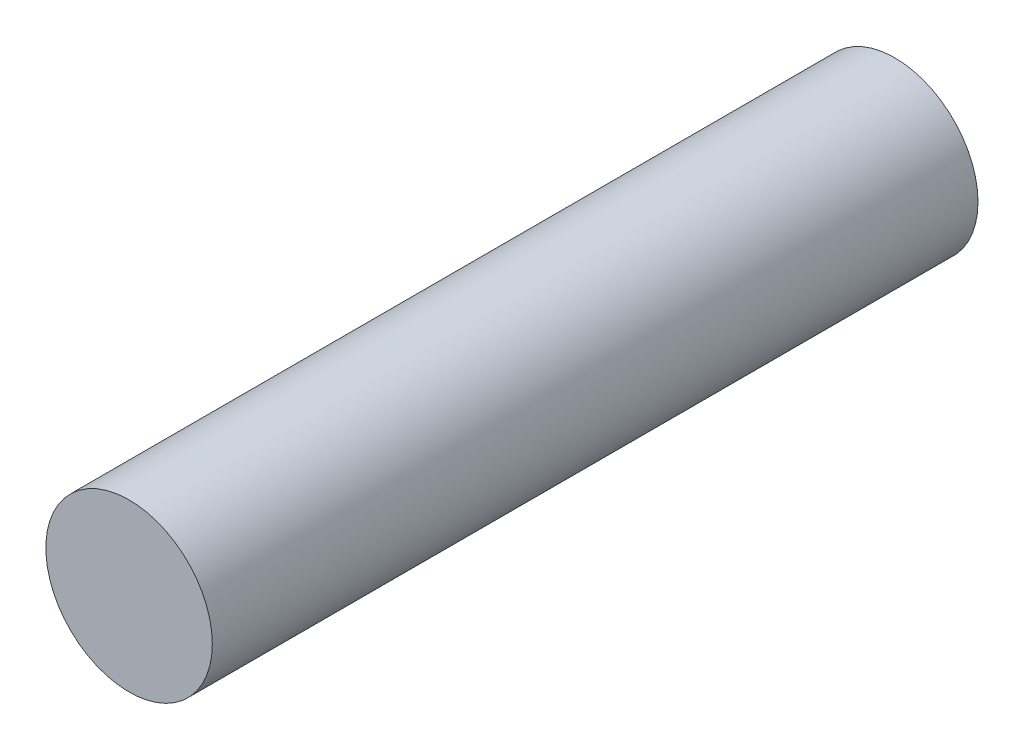
from build123d import *

# Parameters (mm, degrees)
SKETCH1_R           = 2.5
BOSS_EXTRUDE1_DEPTH = 23


with BuildPart() as part:
    # Sketch1 → Boss-Extrude1 (new body)
    with BuildSketch(Plane.XY):
        Circle(SKETCH1_R)
    extrude(amount=BOSS_EXTRUDE1_DEPTH)


solid = part.part
